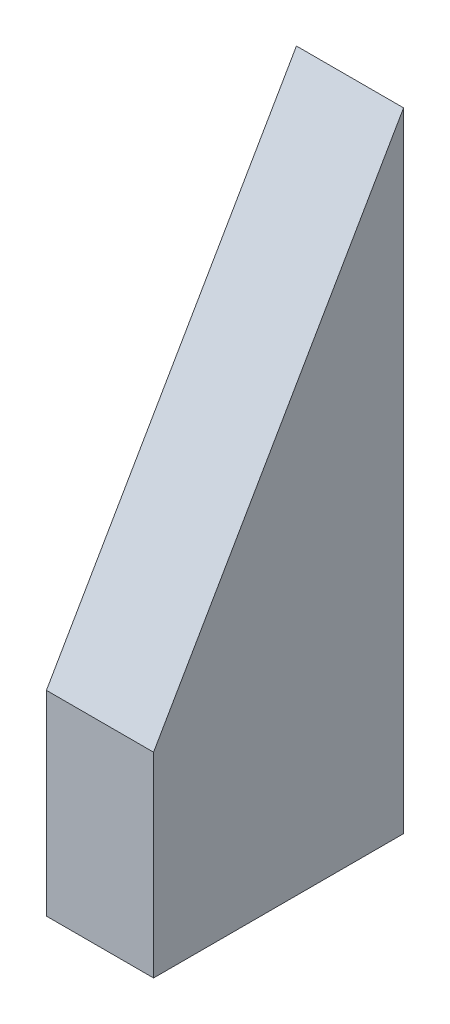
from build123d import *

# Parameters (mm, degrees)
SKETCH1_W               = 37.5
SKETCH1_H               = 87.5
BOSS_EXTRUDE1_DEPTH     = 220
CUT_EXTRUDE1_DEPTH      = 226.090259674
CUT_EXTRUDE1_DEPTH_BACK = 226.090259674


with BuildPart() as part:
    # Sketch1 → Boss-Extrude1 (new body)
    with BuildSketch(Plane(origin=(0, 0, 0), x_dir=(1, 0, 0), z_dir=(0, 1, 0))):
        Rectangle(SKETCH1_W, SKETCH1_H)
    extrude(amount=BOSS_EXTRUDE1_DEPTH)

    # Sketch2 → Cut-Extrude1 (cut, two sides: drawn at the far end of the back side and taken through both)
    with BuildSketch(Plane(origin=(0, 0, 0), x_dir=(0, 0, -1), z_dir=(1, 0, 0)).offset(-CUT_EXTRUDE1_DEPTH_BACK)):
        Polygon((43.75, 220), (-43.75, 68.445554338), (-43.75, 220), align=None)
    extrude(amount=CUT_EXTRUDE1_DEPTH + CUT_EXTRUDE1_DEPTH_BACK, mode=Mode.SUBTRACT)


solid = part.part
